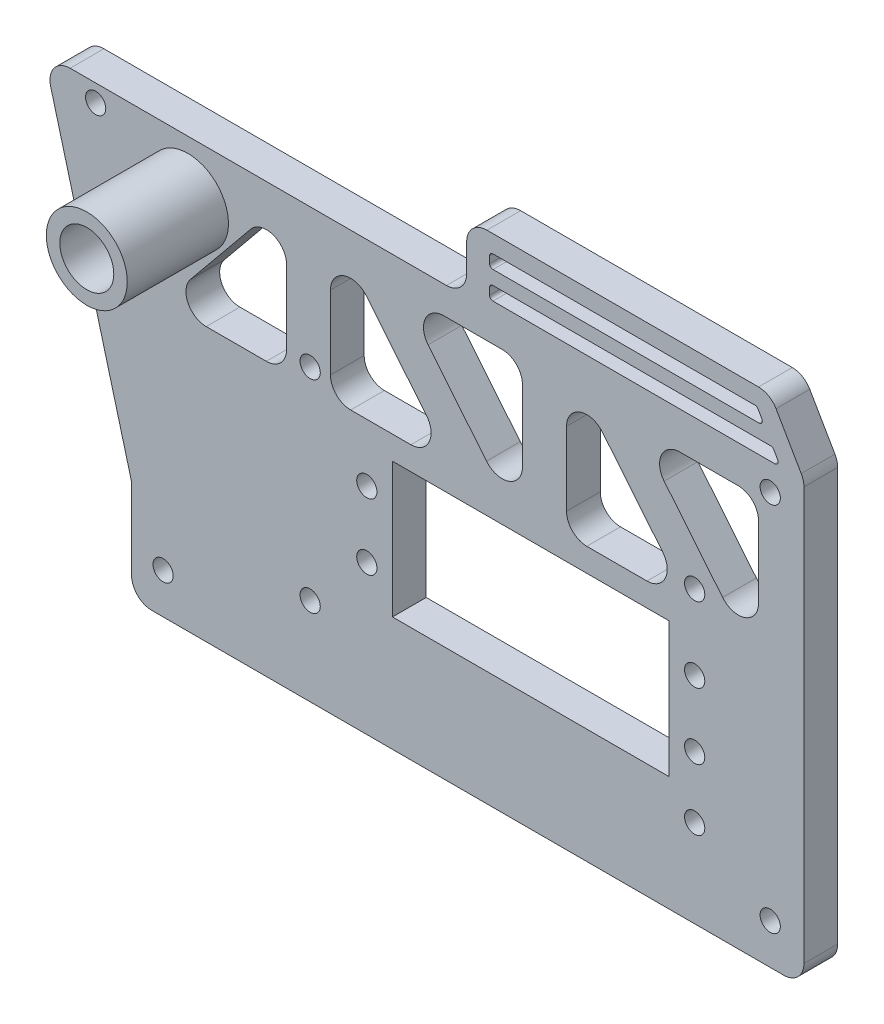
from build123d import *

# Parameters (mm, degrees)
SKETCH_1_R          = 1.5
SKETCH_1_W          = 41
SKETCH_1_H          = 20
EXTRUDE_1_DEPTH     = 5
SKETCH_6_R          = 6
SKETCH_6_R_2        = 4
EXTRUDE_3_DEPTH     = 15
SKETCH_7_R          = 2.5
CUT_EXTRUDE_1_DEPTH = 76.573459736


with BuildPart() as part:
    # 草图1 → 凸台-拉伸1 (new body)
    with BuildSketch(Plane.XY):
        with BuildLine():
            Line((50.475318096, 32.112170347), (50.475318096, -29.083982076))
            ThreePointArc((50.475318096, -29.083982076), (49.59663844, -31.205302419), (47.475318096, -32.083982076))
            Line((47.475318096, -32.083982076), (-46.199426394, -32.083982076))
            ThreePointArc((-46.199426394, -32.083982076), (-48.320746738, -31.205302419), (-49.199426394, -29.083982076))
            Line((-49.199426394, -29.083982076), (-49.199426394, -17.478939569))
            ThreePointArc((-49.199426394, -17.478939569), (-49.22509181, -17.087360992), (-49.301648916, -16.702482433))
            Line((-49.301648916, -16.702482433), (-61.198360071, 27.696648043))
            ThreePointArc((-61.198360071, 27.696648043), (-60.680642613, 30.299389465), (-58.300582592, 31.473105178))
            Line((-58.300582592, 31.473105178), (-2.524681904, 31.473105178))
            ThreePointArc((-2.524681904, 31.473105178), (-0.40336156, 32.351784835), (0.475318096, 34.473105178))
            Line((0.475318096, 34.473105178), (0.475318096, 38.576271962))
            ThreePointArc((0.475318096, 38.576271962), (1.353997752, 40.697592306), (3.475318096, 41.576271962))
            Line((3.475318096, 41.576271962), (43.743267288, 41.576271962))
            ThreePointArc((43.743267288, 41.576271962), (45.243267288, 41.174348173), (46.3413435, 40.076271962))
            Line((46.3413435, 40.076271962), (50.073394307, 33.612170347))
            ThreePointArc((50.073394307, 33.612170347), (50.373095575, 32.888627482), (50.475318096, 32.112170347))
        make_face()
        with Locations((34.275318096, -0.183982076)):
            Circle(SKETCH_1_R, mode=Mode.SUBTRACT)
        with Locations((34.275318096, -9.983982076)):
            Circle(SKETCH_1_R, mode=Mode.SUBTRACT)
        with Locations(Location((-14.324681904, -9.983982076, 0), (0, 0, 180))):
            Circle(SKETCH_1_R, mode=Mode.SUBTRACT)
        with Locations(Location((-14.324681904, -0.183982076, 0), (0, 0, 180))):
            Circle(SKETCH_1_R, mode=Mode.SUBTRACT)
        with Locations((45.475318096, -26.083982076)):
            Circle(SKETCH_1_R, mode=Mode.SUBTRACT)
        with Locations((45.475318096, 28.916017924)):
            Circle(SKETCH_1_R, mode=Mode.SUBTRACT)
        with Locations((-44.524681904, -26.083982076)):
            Circle(SKETCH_1_R, mode=Mode.SUBTRACT)
        with Locations((-54.524681904, 28.916017924)):
            Circle(SKETCH_1_R, mode=Mode.SUBTRACT)
        with Locations((34.275318096, 10.916017924)):
            Circle(SKETCH_1_R, mode=Mode.SUBTRACT)
        with Locations((-22.724681904, 10.916017924)):
            Circle(SKETCH_1_R, mode=Mode.SUBTRACT)
        with Locations((34.275318096, -19.083982076)):
            Circle(SKETCH_1_R, mode=Mode.SUBTRACT)
        with Locations((-22.724681904, -19.083982076)):
            Circle(SKETCH_1_R, mode=Mode.SUBTRACT)
        with Locations((9.975318096, -5.083982076)):
            Rectangle(SKETCH_1_W, SKETCH_1_H, mode=Mode.SUBTRACT)
        with BuildLine():
            Line((43.743267288, 24.388896624), (43.743267288, 13.793120092))
            ThreePointArc((43.743267288, 13.793120092), (41.751826733, 10.967733774), (38.421395391, 11.893406721))
            Line((38.421395391, 11.893406721), (29.752123683, 22.489183253))
            ThreePointArc((29.752123683, 22.489183253), (29.362986533, 25.673587226), (32.07399558, 27.388896624))
            Line((32.07399558, 27.388896624), (40.743267288, 27.388896624))
            ThreePointArc((40.743267288, 27.388896624), (42.864587632, 26.510216968), (43.743267288, 24.388896624))
        make_face(mode=Mode.SUBTRACT)
        with BuildLine():
            Line((27.205627867, 8.388896624), (18.282890218, 8.388896624))
            ThreePointArc((18.282890218, 8.388896624), (16.161569875, 9.26757628), (15.282890218, 11.388896624))
            Line((15.282890218, 11.388896624), (15.282890218, 22.294464861))
            ThreePointArc((15.282890218, 22.294464861), (17.274330774, 25.11985118), (20.604762116, 24.194178232))
            Line((20.604762116, 24.194178232), (29.527499765, 13.288609995))
            ThreePointArc((29.527499765, 13.288609995), (29.916636915, 10.104206022), (27.205627867, 8.388896624))
        make_face(mode=Mode.SUBTRACT)
        with BuildLine():
            Line((-2.92600442, 27.388896624), (5.743267288, 27.388896624))
            ThreePointArc((5.743267288, 27.388896624), (7.864587632, 26.510216968), (8.743267288, 24.388896624))
            Line((8.743267288, 24.388896624), (8.743267288, 13.793120092))
            ThreePointArc((8.743267288, 13.793120092), (6.751826733, 10.967733774), (3.421395391, 11.893406721))
            Line((3.421395391, 11.893406721), (-5.247876317, 22.489183253))
            ThreePointArc((-5.247876317, 22.489183253), (-5.637013467, 25.673587226), (-2.92600442, 27.388896624))
        make_face(mode=Mode.SUBTRACT)
        with BuildLine():
            Line((-7.794372133, 8.388896624), (-16.717109782, 8.388896624))
            ThreePointArc((-16.717109782, 8.388896624), (-18.838430125, 9.26757628), (-19.717109782, 11.388896624))
            Line((-19.717109782, 11.388896624), (-19.717109782, 22.294464861))
            ThreePointArc((-19.717109782, 22.294464861), (-17.725669226, 25.11985118), (-14.395237884, 24.194178232))
            Line((-14.395237884, 24.194178232), (-5.472500235, 13.288609995))
            ThreePointArc((-5.472500235, 13.288609995), (-5.083363085, 10.104206022), (-7.794372133, 8.388896624))
        make_face(mode=Mode.SUBTRACT)
        with BuildLine():
            Line((-38.13984743, 8.388896624), (-29.217109782, 8.388896624))
            ThreePointArc((-29.217109782, 8.388896624), (-27.095789438, 9.26757628), (-26.217109782, 11.388896624))
            Line((-26.217109782, 11.388896624), (-26.217109782, 22.294464861))
            ThreePointArc((-26.217109782, 22.294464861), (-28.208550337, 25.11985118), (-31.538981679, 24.194178232))
            Line((-31.538981679, 24.194178232), (-40.461719328, 13.288609995))
            ThreePointArc((-40.461719328, 13.288609995), (-40.850856478, 10.104206022), (-38.13984743, 8.388896624))
        make_face(mode=Mode.SUBTRACT)
        with BuildLine():
            Line((43.656664748, 38.726271962), (44.234015017, 37.726271962))
            ThreePointArc((44.234015017, 37.726271962), (44.234015017, 37.226271962), (43.801002315, 36.976271962))
            Line((43.801002315, 36.976271962), (4.377241885, 36.976271962))
            ThreePointArc((4.377241885, 36.976271962), (4.023688494, 37.122718571), (3.877241885, 37.476271962))
            Line((3.877241885, 37.476271962), (3.877241885, 38.476271962))
            ThreePointArc((3.877241885, 38.476271962), (4.023688494, 38.829825353), (4.377241885, 38.976271962))
            Line((4.377241885, 38.976271962), (43.223652046, 38.976271962))
            ThreePointArc((43.223652046, 38.976271962), (43.473652046, 38.909284664), (43.656664748, 38.726271962))
        make_face(mode=Mode.SUBTRACT)
        with BuildLine():
            Line((45.567840808, 34.916017924), (4.377241885, 34.916017924))
            ThreePointArc((4.377241885, 34.916017924), (4.023688494, 34.769571315), (3.877241885, 34.416017924))
            Line((3.877241885, 34.416017924), (3.877241885, 33.416017924))
            ThreePointArc((3.877241885, 33.416017924), (4.023688494, 33.062464534), (4.377241885, 32.916017924))
            Line((4.377241885, 32.916017924), (46.145191077, 32.916017924))
            ThreePointArc((46.145191077, 32.916017924), (46.578203779, 33.166017924), (46.578203779, 33.666017924))
            Line((46.578203779, 33.666017924), (46.00085351, 34.666017924))
            ThreePointArc((46.00085351, 34.666017924), (45.817840808, 34.849030626), (45.567840808, 34.916017924))
        make_face(mode=Mode.SUBTRACT)
    extrude(amount=EXTRUDE_1_DEPTH)

    # 草图6 → 凸台-拉伸3 (add)
    with BuildSketch(Plane.XY.offset(5)):
        with Locations(Location((-40.836658363, 23.267301815, 0), (0, 0, 180))):
            Circle(SKETCH_6_R)
        with Locations((-40.836658363, 23.267301815)):
            Circle(SKETCH_6_R_2, mode=Mode.SUBTRACT)
    extrude(amount=EXTRUDE_3_DEPTH)

    # 草图7 → 切除-拉伸1 (cut, through all)
    with BuildSketch(Plane.XY.offset(5)):
        with Locations((-40.836658363, 23.267301815)):
            Circle(SKETCH_7_R)
    extrude(amount=-CUT_EXTRUDE_1_DEPTH, mode=Mode.SUBTRACT)


solid = part.part
